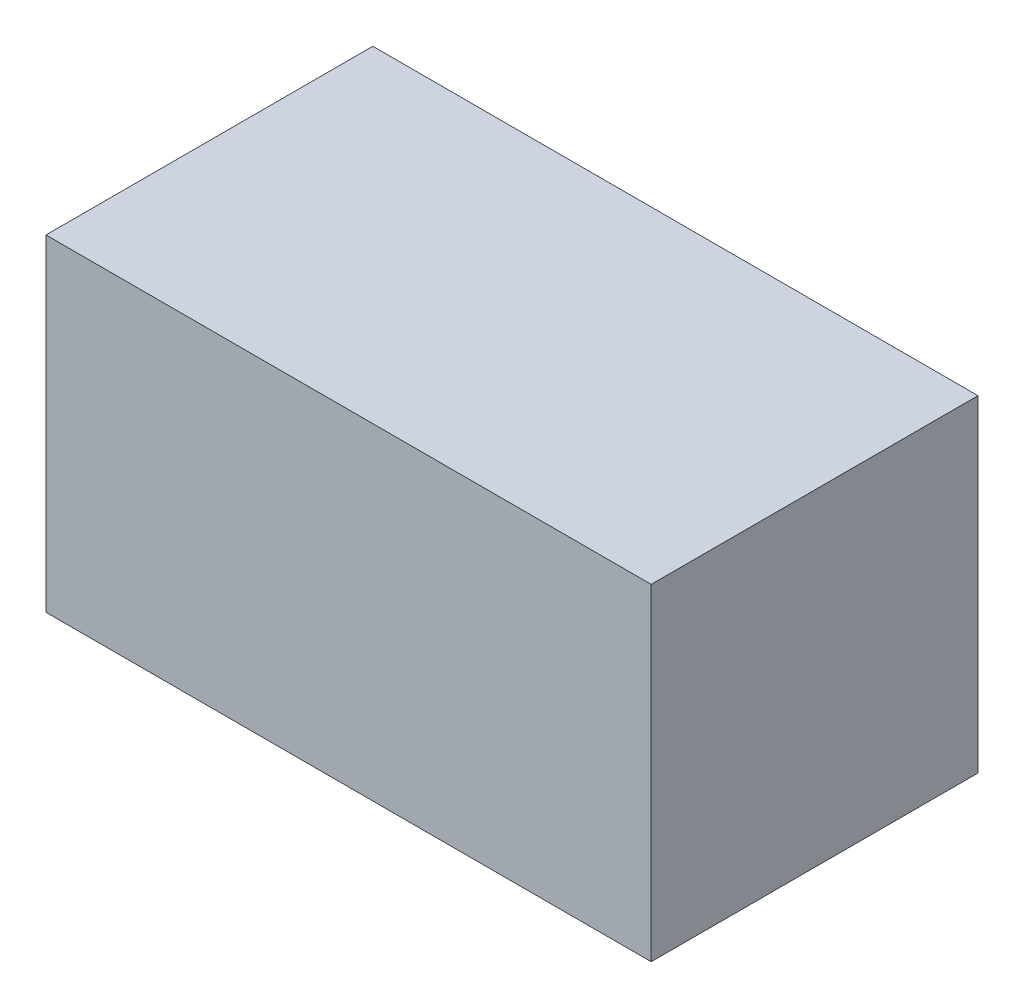
from build123d import *

# Parameters (mm, degrees)
SKETCH_1_W              = 2.5
SKETCH_1_H              = 1.35
COMPONENT_OUTLINE_DEPTH = 1.35


with BuildPart() as part:
    # 草图1 → Component_Outline (new body)
    with BuildSketch(Plane.XY):
        Rectangle(SKETCH_1_W, SKETCH_1_H)
    extrude(amount=COMPONENT_OUTLINE_DEPTH)


solid = part.part
